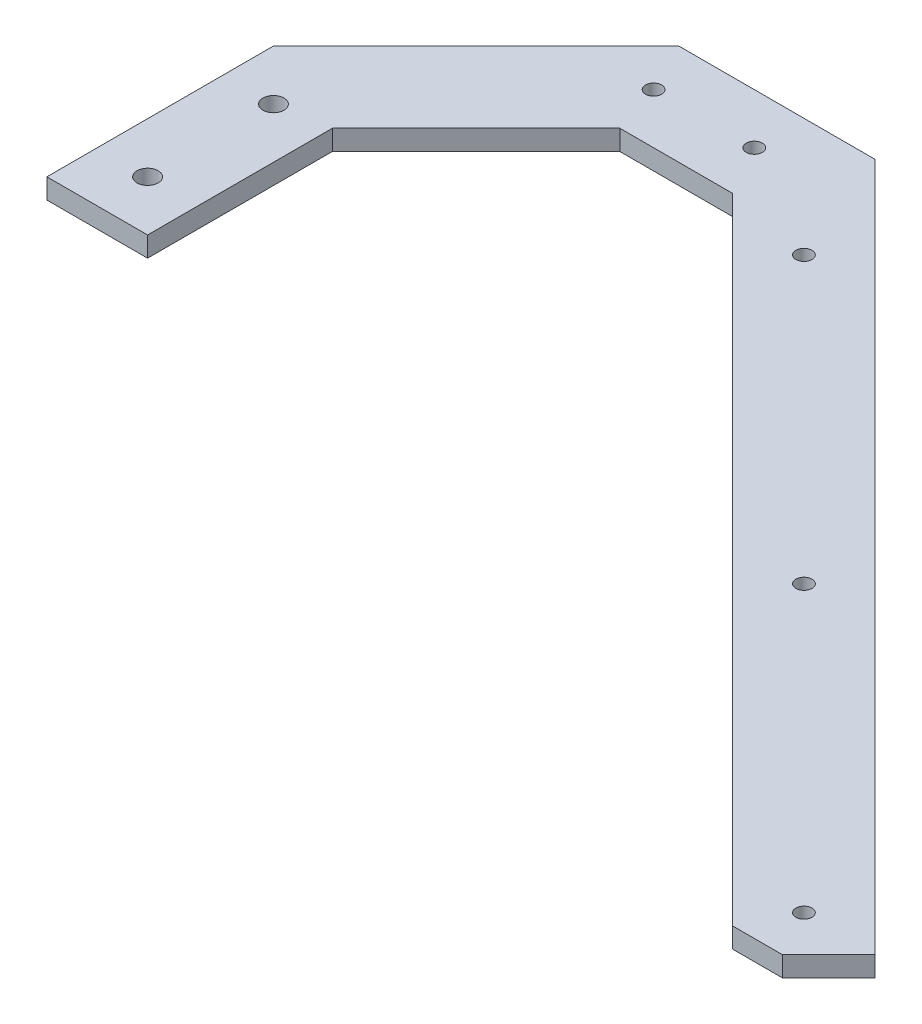
from build123d import *

# Parameters (mm, degrees)
SKETCH_1_R          = 2.1
EXTRUDE_1_DEPTH     = 4
CUT_EXTRUDE_1_DEPTH = 10
SKETCH_3_R          = 1.6
CUT_EXTRUDE_2_DEPTH = 50
CUT_EXTRUDE_3_DEPTH = 50
SKETCH_5_R          = 1.6
CUT_EXTRUDE_4_DEPTH = 50


with BuildPart() as part:
    # 草图1 → 凸台-拉伸1 (new body)
    with BuildSketch(Plane(origin=(0, 0, 0), x_dir=(1, 0, 0), z_dir=(0, 1, 0))):
        Polygon((20, 0), (0, 0), (0, 45), (40.25, 85.25), (79.25, 85.25), (225.25, -60.75), (225.25, -99.75), (185, -140), (140, -140), (140, -120), (176.715728753, -120), (205.25, -91.465728753), (205.25, -69.034271247), (70.965728753, 65.25), (48.534271247, 65.25), (20, 36.715728753), align=None)
        with Locations(Location((10, 10, 0), (0, 0, 270))):
            Circle(SKETCH_1_R, mode=Mode.SUBTRACT)
        with Locations(Location((10, 35, 0), (0, 0, 90))):
            Circle(SKETCH_1_R, mode=Mode.SUBTRACT)
        with Locations(Location((175, -130, 0), (0, 0, 270))):
            Circle(SKETCH_1_R, mode=Mode.SUBTRACT)
        with Locations(Location((150, -130, 0), (0, 0, 90))):
            Circle(SKETCH_1_R, mode=Mode.SUBTRACT)
    extrude(amount=EXTRUDE_1_DEPTH)

    # 草图2 → 切除-拉伸1 (cut)
    with BuildSketch(Plane(origin=(0, 4, 0), x_dir=(1, 0, 0), z_dir=(0, 1, 0))):
        Polygon((225.25, -60.75), (225.25, -99.75), (185, -140), (140, -140), (140, -120), (176.715728753, -120), (205.25, -91.465728753), (205.25, -69.034271247), (196.965728753, -60.75), align=None)
    extrude(amount=-CUT_EXTRUDE_1_DEPTH, mode=Mode.SUBTRACT)

    # 草图3 → 切除-拉伸2 (cut)
    with BuildSketch(Plane(origin=(0, 4, 0), x_dir=(1, 0, 0), z_dir=(0, 1, 0))):
        with Locations(Location((201.747474683, -51.389610307, 0), (0, 0, 270))):
            Circle(SKETCH_3_R)
        with Locations(Location((88.610389693, 61.747474683, 0), (0, 0, 270))):
            Circle(SKETCH_3_R)
        with Locations(Location((145.178932188, 5.178932188, 0), (0, 0, 270))):
            Circle(SKETCH_3_R)
    extrude(amount=-CUT_EXTRUDE_2_DEPTH, mode=Mode.SUBTRACT)

    # 草图4 → 切除-拉伸3 (cut)
    with BuildSketch(Plane(origin=(0, 4, 0), x_dir=(1, 0, 0), z_dir=(0, 1, 0))):
        Polygon((225.25, -60.75), (216.057611845, -51.557611845), (206.865223689, -60.75), align=None)
    extrude(amount=-CUT_EXTRUDE_3_DEPTH, mode=Mode.SUBTRACT)

    # 草图5 → 切除-拉伸4 (cut)
    with BuildSketch(Plane(origin=(0, 4, 0), x_dir=(1, 0, 0), z_dir=(0, 1, 0))):
        with Locations(Location((65.25, 75.25, 0), (0, 0, 270))):
            Circle(SKETCH_5_R)
        with Locations(Location((45.25, 75.25, 0), (0, 0, 270))):
            Circle(SKETCH_5_R)
    extrude(amount=-CUT_EXTRUDE_4_DEPTH, mode=Mode.SUBTRACT)


solid = part.part
